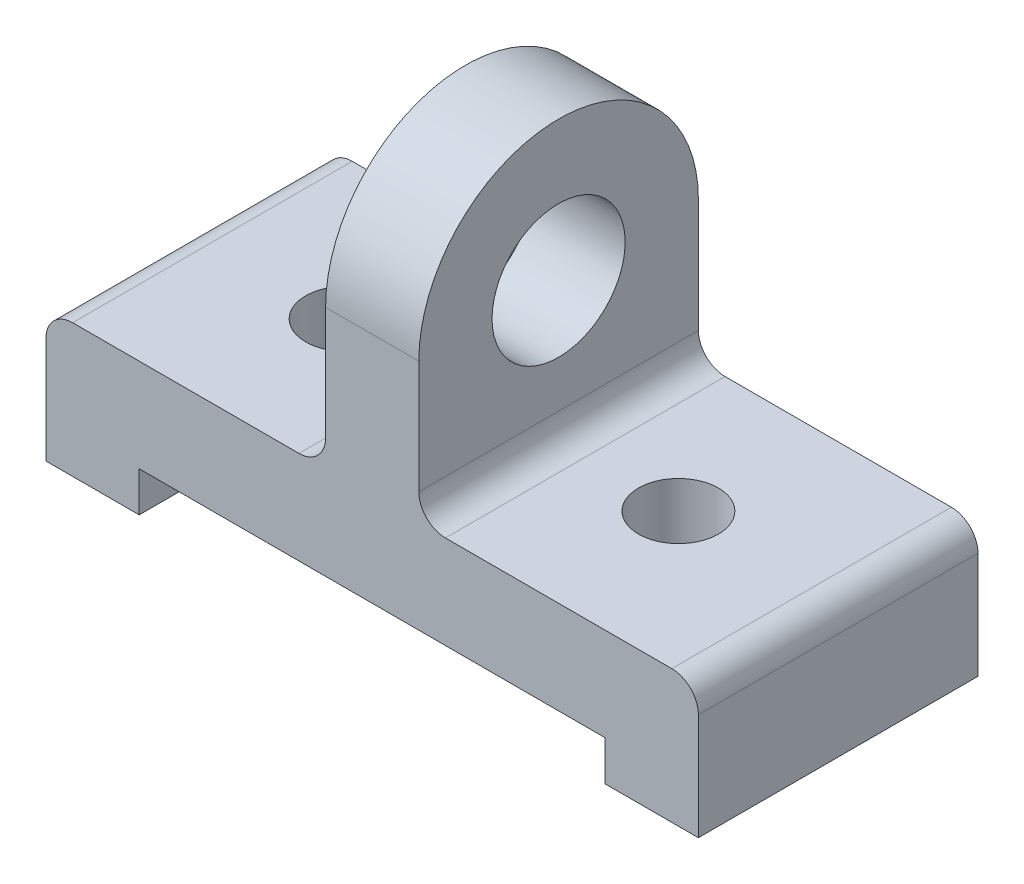
from build123d import *

# Parameters (mm, degrees)
BOSS_EXTRUDE1_DEPTH = 42
SKETCH3_R           = 10
BOSS_EXTRUDE2_DEPTH = 7
SKETCH4_R           = 6
CUT_EXTRUDE1_DEPTH  = 69.942004613
FILLET1_R           = 4


with BuildPart() as part:
    # Sketch1 → Boss-Extrude1 (new body)
    with BuildSketch(Plane.XY):
        Polygon((0, 0), (0, -6), (14, -6), (14, 14), (-35, 14), (-35, 0), align=None)
    extrude(amount=BOSS_EXTRUDE1_DEPTH)

    # Sketch3 → Boss-Extrude2 (add)
    with BuildSketch(Plane.ZY.offset(28)):
        with BuildLine():
            Line((0, 14), (42, 14))
            Line((42, 14), (42, 35))
            ThreePointArc((42, 35), (21, 56), (0, 35))
            Line((0, 35), (0, 14))
        make_face()
        with Locations((21, 35)):
            Circle(SKETCH3_R, mode=Mode.SUBTRACT)
    extrude(amount=BOSS_EXTRUDE2_DEPTH)

    # Sketch4 → Cut-Extrude1 (cut, through all)
    with BuildSketch(Plane(origin=(0, 14, 0), x_dir=(1, 0, 0), z_dir=(0, 1, 0))):
        with Locations(Location((-10, -21, 0), (0, 0, 180))):
            Circle(SKETCH4_R)
    extrude(amount=-CUT_EXTRUDE1_DEPTH, mode=Mode.SUBTRACT)

    # Fillet1
    fillet1_edges = [part.edges().sort_by_distance(p)[0] for p in [
        (14, 14, 21),
        (-28, 14, 21),
    ]]
    fillet(fillet1_edges, radius=FILLET1_R)

    # Mirror2: part across plane


with BuildPart() as part_1:
    add(part.part)
    add(part.part.mirror(Plane(origin=(-35, 14, 42), x_dir=(0, 0, 1), z_dir=(1, 0, 0))))


solid = part_1.part
